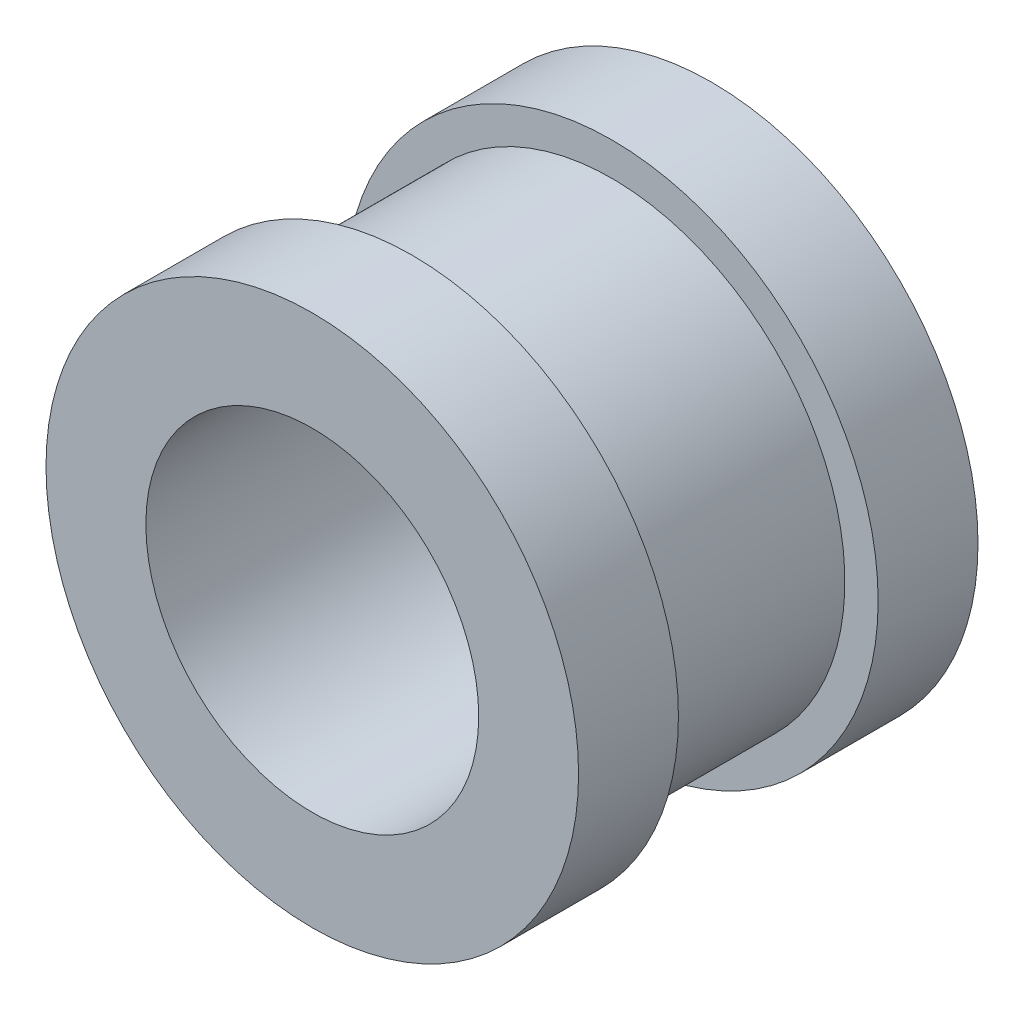
from build123d import *

# Parameters (mm, degrees)
SKETCH1_R           = 8
SKETCH1_R_2         = 5
BOSS_EXTRUDE1_DEPTH = 12
SKETCH2_W           = 1
SKETCH2_H           = 6


with BuildPart() as part:
    # Sketch1 → Boss-Extrude1 (new body)
    with BuildSketch(Plane.XY):
        Circle(SKETCH1_R)
        Circle(SKETCH1_R_2, mode=Mode.SUBTRACT)
    extrude(amount=BOSS_EXTRUDE1_DEPTH)

    # Sketch2 → Cut-Revolve1 (revolve, cut)
    with BuildSketch(Plane(origin=(0, 0, 0), x_dir=(1, 0, 0), z_dir=(0, 1, 0))):
        with Locations((-7.5, -6)):
            Rectangle(SKETCH2_W, SKETCH2_H)
    revolve(axis=Axis((0, 0, -2.730196635), (0, 0, 1)), mode=Mode.SUBTRACT)


solid = part.part
